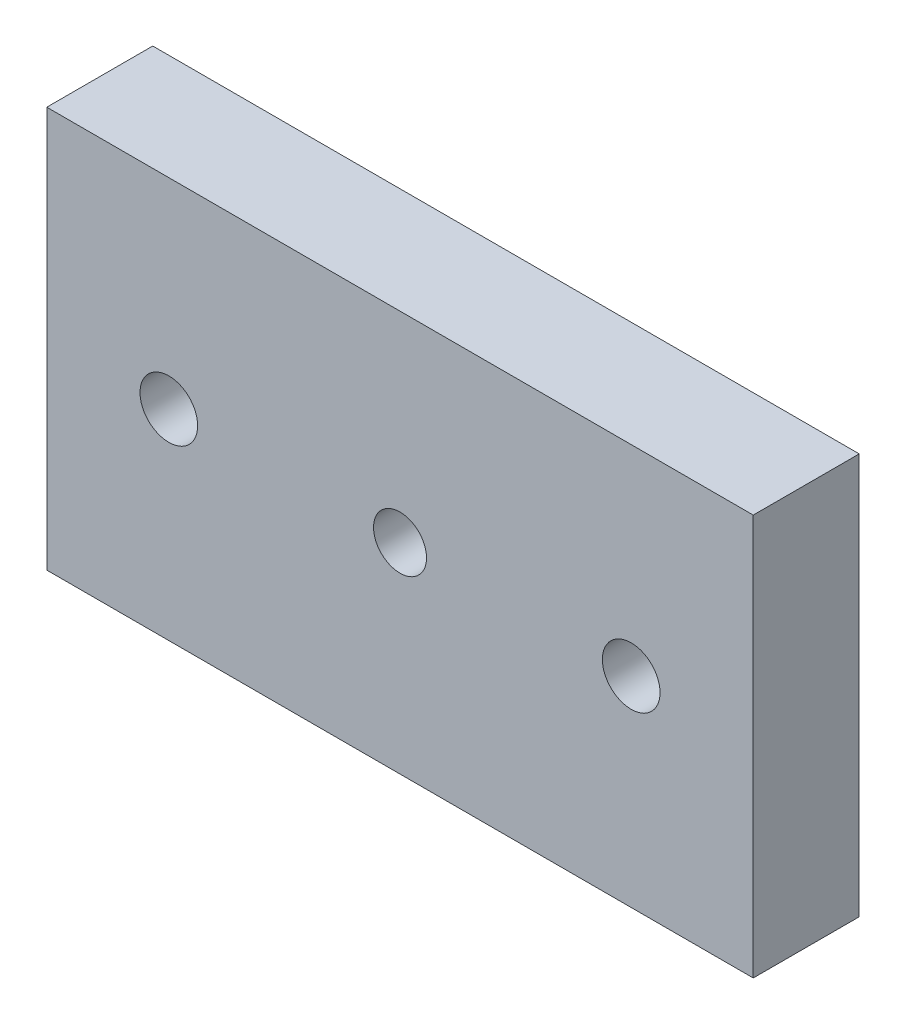
from build123d import *

# Parameters (mm, degrees)
SKETCH1_W             = 40
SKETCH1_H             = 22.7
BOSS_EXTRUDE1_DEPTH   = 6
F_4_CLEARANCE_HOLE1_D = 3.2639
F_3_0MM_DOWEL_HOLE1_D = 3


with BuildPart() as part:
    # Sketch1 → Boss-Extrude1 (new body)
    with BuildSketch(Plane.XY):
        Rectangle(SKETCH1_W, SKETCH1_H)
    extrude(amount=-BOSS_EXTRUDE1_DEPTH)

    # #4 Clearance Hole1 (through all)
    with Locations(Plane.XY):
        with Locations((-13.09, 0), (13.09, 0)):
            Hole(F_4_CLEARANCE_HOLE1_D / 2)

    # Ø3.0mm Dowel Hole1 (through all)
    with Locations(Plane.XY):
        with Locations((0, 0)):
            Hole(F_3_0MM_DOWEL_HOLE1_D / 2)


solid = part.part
